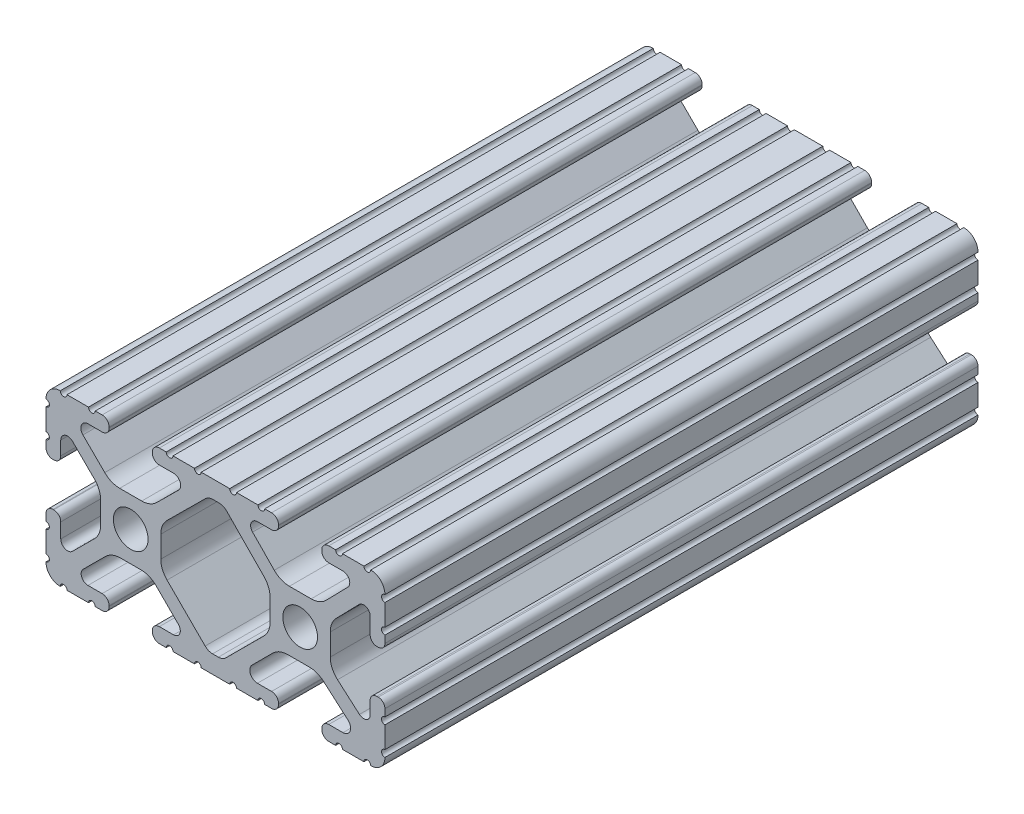
from build123d import *

# Parameters (mm, degrees)
SKETCH1_R           = 2.6035
BOSS_EXTRUDE1_DEPTH = 44.45


with BuildPart() as part:
    # Sketch1 → Boss-Extrude1 (new, symmetric)
    with BuildSketch(Plane.XY):
        with BuildLine():
            Line((18.01710265, 12.7), (16.98745015, 12.7))
            ThreePointArc((16.98745015, 12.7), (16.245730386, 12.392769614), (15.9385, 11.65104985))
            Line((15.9385, 11.65104985), (15.9385, 11.53922))
            ThreePointArc((15.9385, 11.53922), (16.245750844, 10.797450844), (16.98752, 10.4902))
            Line((16.98752, 10.4902), (19.116384363, 10.4902))
            ThreePointArc((19.116384363, 10.4902), (20.052502933, 9.869096983), (19.844087081, 8.765172272))
            Line((19.844087081, 8.765172272), (16.618993479, 5.455112286))
            ThreePointArc((16.618993479, 5.455112286), (15.578994274, 4.745442459), (14.344932584, 4.4958))
            Line((14.344932584, 4.4958), (11.083317835, 4.4958))
            ThreePointArc((11.083317835, 4.4958), (9.854330953, 4.743306833), (8.816955189, 5.447238587))
            Line((8.816955189, 5.447238587), (5.564154119, 8.762652677))
            ThreePointArc((5.564154119, 8.762652677), (5.352591412, 9.867473037), (6.289393385, 10.4902))
            Line((6.289393385, 10.4902), (8.41248, 10.4902))
            ThreePointArc((8.41248, 10.4902), (9.154249156, 10.797450844), (9.4615, 11.53922))
            Line((9.4615, 11.53922), (9.4615, 11.65104985))
            ThreePointArc((9.4615, 11.65104985), (9.154269614, 12.392769614), (8.41254985, 12.7))
            Line((8.41254985, 12.7), (7.38288465, 12.7))
            ThreePointArc((7.38288465, 12.7), (6.87488465, 12.192), (6.36688465, 12.7))
            Line((6.36688465, 12.7), (3.14958095, 12.7))
            ThreePointArc((3.14958095, 12.7), (2.64158095, 12.192), (2.13358095, 12.7))
            Line((2.13358095, 12.7), (-2.13358095, 12.7))
            ThreePointArc((-2.13358095, 12.7), (-2.64158095, 12.192), (-3.14958095, 12.7))
            Line((-3.14958095, 12.7), (-6.36689735, 12.7))
            ThreePointArc((-6.36689735, 12.7), (-6.87489735, 12.192), (-7.38289735, 12.7))
            Line((-7.38289735, 12.7), (-8.41254985, 12.7))
            ThreePointArc((-8.41254985, 12.7), (-9.154269614, 12.392769614), (-9.4615, 11.65104985))
            Line((-9.4615, 11.65104985), (-9.4615, 11.53922))
            ThreePointArc((-9.4615, 11.53922), (-9.154249156, 10.797450844), (-8.41248, 10.4902))
            Line((-8.41248, 10.4902), (-6.283641037, 10.4902))
            ThreePointArc((-6.283641037, 10.4902), (-5.297291557, 9.829633109), (-5.532576693, 8.666071843))
            Line((-5.532576693, 8.666071843), (-8.809985098, 5.416263103))
            ThreePointArc((-8.809985098, 5.416263103), (-9.836720513, 4.734920264), (-11.045536121, 4.4958))
            Line((-11.045536121, 4.4958), (-14.354463879, 4.4958))
            ThreePointArc((-14.354463879, 4.4958), (-15.563279487, 4.734920264), (-16.590014902, 5.416263103))
            Line((-16.590014902, 5.416263103), (-19.867423307, 8.666071843))
            ThreePointArc((-19.867423307, 8.666071843), (-20.102708443, 9.829633109), (-19.116358963, 10.4902))
            Line((-19.116358963, 10.4902), (-16.98752, 10.4902))
            ThreePointArc((-16.98752, 10.4902), (-16.245750844, 10.797450844), (-15.9385, 11.53922))
            Line((-15.9385, 11.53922), (-15.9385, 11.65104985))
            ThreePointArc((-15.9385, 11.65104985), (-16.245730386, 12.392769614), (-16.98745015, 12.7))
            Line((-16.98745015, 12.7), (-18.01711535, 12.7))
            ThreePointArc((-18.01711535, 12.7), (-18.52511535, 12.192), (-19.03311535, 12.7))
            Line((-19.03311535, 12.7), (-22.2504, 12.7))
            ThreePointArc((-22.2504, 12.7), (-22.758323491, 12.192000006), (-23.266399977, 12.699846982))
            ThreePointArc((-23.266399977, 12.699846982), (-24.782522516, 12.082522516), (-25.399846982, 10.566399977))
            ThreePointArc((-25.399846982, 10.566399977), (-24.892000006, 10.058323491), (-25.4, 9.5504))
            Line((-25.4, 9.5504), (-25.4, 6.3330836))
            ThreePointArc((-25.4, 6.3330836), (-24.892, 5.8250836), (-25.4, 5.3170836))
            Line((-25.4, 5.3170836), (-25.4, 4.237520184))
            ThreePointArc((-25.4, 4.237520184), (-25.107393763, 3.531106237), (-24.400979816, 3.2385))
            Line((-24.400979816, 3.2385), (-24.23922, 3.2385))
            ThreePointArc((-24.23922, 3.2385), (-23.497450844, 3.545750844), (-23.1902, 4.28752))
            Line((-23.1902, 4.28752), (-23.1902, 6.334741132))
            ThreePointArc((-23.1902, 6.334741132), (-22.556026952, 7.286023527), (-21.434002553, 7.066535717))
            Line((-21.434002553, 7.066535717), (-18.147950853, 3.808156468))
            ThreePointArc((-18.147950853, 3.808156468), (-17.452759693, 2.774838327), (-17.208501877, 1.553619571))
            Line((-17.208501877, 1.553619571), (-17.208501877, -1.695179196))
            ThreePointArc((-17.208501877, -1.695179196), (-17.450738657, -2.911536421), (-18.140486065, -3.942289578))
            Line((-18.140486065, -3.942289578), (-21.431579576, -7.227386226))
            ThreePointArc((-21.431579576, -7.227386226), (-22.55444896, -7.449940594), (-23.1902, -6.498002195))
            Line((-23.1902, -6.498002195), (-23.1902, -4.28752))
            ThreePointArc((-23.1902, -4.28752), (-23.497450844, -3.545750844), (-24.23922, -3.2385))
            Line((-24.23922, -3.2385), (-24.35098, -3.2385))
            ThreePointArc((-24.35098, -3.2385), (-25.092749156, -3.545750844), (-25.4, -4.28752))
            Line((-25.4, -4.28752), (-25.4, -5.3171344))
            ThreePointArc((-25.4, -5.3171344), (-24.892, -5.8251344), (-25.4, -6.3331344))
            Line((-25.4, -6.3331344), (-25.4, -9.5504))
            ThreePointArc((-25.4, -9.5504), (-24.892000006, -10.058323491), (-25.399846982, -10.566399977))
            ThreePointArc((-25.399846982, -10.566399977), (-24.782522516, -12.082522516), (-23.266399977, -12.699846982))
            ThreePointArc((-23.266399977, -12.699846982), (-22.758323491, -12.192000006), (-22.2504, -12.7))
            Line((-22.2504, -12.7), (-19.03308995, -12.7))
            ThreePointArc((-19.03308995, -12.7), (-18.52508995, -12.192), (-18.01708995, -12.7))
            Line((-18.01708995, -12.7), (-16.9874692, -12.7))
            ThreePointArc((-16.9874692, -12.7), (-16.245700044, -12.392749156), (-15.9384492, -11.65098))
            Line((-15.9384492, -11.65098), (-15.9384492, -11.53922))
            ThreePointArc((-15.9384492, -11.53922), (-16.245700044, -10.797450844), (-16.9874692, -10.4902))
            Line((-16.9874692, -10.4902), (-19.116358963, -10.4902))
            ThreePointArc((-19.116358963, -10.4902), (-20.055197748, -9.862578342), (-19.834124023, -8.755124678))
            Line((-19.834124023, -8.755124678), (-16.49660751, -5.423689618))
            ThreePointArc((-16.49660751, -5.423689618), (-15.467274017, -4.736928798), (-14.253591699, -4.4958))
            Line((-14.253591699, -4.4958), (-11.146408301, -4.4958))
            ThreePointArc((-11.146408301, -4.4958), (-9.932725983, -4.736928798), (-8.90339249, -5.423689618))
            Line((-8.90339249, -5.423689618), (-5.565875977, -8.755124678))
            ThreePointArc((-5.565875977, -8.755124678), (-5.344802252, -9.862578342), (-6.283641037, -10.4902))
            Line((-6.283641037, -10.4902), (-8.4125308, -10.4902))
            ThreePointArc((-8.4125308, -10.4902), (-9.154299956, -10.797450844), (-9.4615508, -11.53922))
            Line((-9.4615508, -11.53922), (-9.4615508, -11.65098))
            ThreePointArc((-9.4615508, -11.65098), (-9.154299956, -12.392749156), (-8.4125308, -12.7))
            Line((-8.4125308, -12.7), (-7.38287195, -12.7))
            ThreePointArc((-7.38287195, -12.7), (-6.87487195, -12.192), (-6.36687195, -12.7))
            Line((-6.36687195, -12.7), (-3.14960635, -12.7))
            ThreePointArc((-3.14960635, -12.7), (-2.64160635, -12.192), (-2.13360635, -12.7))
            Line((-2.13360635, -12.7), (2.13360635, -12.7))
            ThreePointArc((2.13360635, -12.7), (2.64159365, -12.1920127), (3.14958095, -12.7))
            Line((3.14958095, -12.7), (6.36691005, -12.7))
            ThreePointArc((6.36691005, -12.7), (6.87491005, -12.192), (7.38291005, -12.7))
            Line((7.38291005, -12.7), (8.4125308, -12.7))
            ThreePointArc((8.4125308, -12.7), (9.154299956, -12.392749156), (9.4615508, -11.65098))
            Line((9.4615508, -11.65098), (9.4615508, -11.53922))
            ThreePointArc((9.4615508, -11.53922), (9.154299956, -10.797450844), (8.4125308, -10.4902))
            Line((8.4125308, -10.4902), (6.289393385, -10.4902))
            ThreePointArc((6.289393385, -10.4902), (5.231590322, -9.783049717), (5.480677245, -8.535265862))
            Line((5.480677245, -8.535265862), (8.597933595, -5.423689618))
            ThreePointArc((8.597933595, -5.423689618), (9.627267088, -4.736928798), (10.840949406, -4.4958))
            Line((10.840949406, -4.4958), (14.102564155, -4.4958))
            ThreePointArc((14.102564155, -4.4958), (15.215927525, -4.697410182), (16.187895372, -5.276636531))
            Line((16.187895372, -5.276636531), (19.868247549, -8.482246082))
            ThreePointArc((19.868247549, -8.482246082), (20.188435806, -9.746879864), (19.116384363, -10.4902))
            Line((19.116384363, -10.4902), (16.9874692, -10.4902))
            ThreePointArc((16.9874692, -10.4902), (16.245700044, -10.797450844), (15.9384492, -11.53922))
            Line((15.9384492, -11.53922), (15.9384492, -11.65098))
            ThreePointArc((15.9384492, -11.65098), (16.245700044, -12.392749156), (16.9874692, -12.7))
            Line((16.9874692, -12.7), (18.01710265, -12.7))
            ThreePointArc((18.01710265, -12.7), (18.52510265, -12.192), (19.03310265, -12.7))
            Line((19.03310265, -12.7), (22.2504, -12.7))
            ThreePointArc((22.2504, -12.7), (22.758323491, -12.192000006), (23.266399977, -12.699846982))
            ThreePointArc((23.266399977, -12.699846982), (24.782522516, -12.082522516), (25.399846982, -10.566399977))
            ThreePointArc((25.399846982, -10.566399977), (24.892000006, -10.058323492), (25.4, -9.550400001))
            Line((25.4, -9.550400001), (25.4, -6.333083592))
            ThreePointArc((25.4, -6.333083592), (24.892000001, -5.825083593), (25.4, -5.317083593))
            Line((25.4, -5.317083593), (25.4, -4.237520184))
            ThreePointArc((25.4, -4.237520184), (25.107393763, -3.531106237), (24.400979816, -3.2385))
            Line((24.400979816, -3.2385), (24.189220184, -3.2385))
            ThreePointArc((24.189220184, -3.2385), (23.482806237, -3.531106237), (23.1902, -4.237520184))
            Line((23.1902, -4.237520184), (23.1902, -6.155876159))
            ThreePointArc((23.1902, -6.155876159), (22.62232736, -7.038258539), (21.583974541, -6.886926384))
            Line((21.583974541, -6.886926384), (18.29817066, -4.024970844))
            ThreePointArc((18.29817066, -4.024970844), (17.493730985, -2.946044689), (17.208501877, -1.630807374))
            Line((17.208501877, -1.630807374), (17.208501877, 1.630807374))
            ThreePointArc((17.208501877, 1.630807374), (17.442348332, 2.82673414), (18.109440981, 3.846495088))
            Line((18.109440981, 3.846495088), (21.526346532, 7.353420386))
            ThreePointArc((21.526346532, 7.353420386), (22.585896263, 7.574939077), (23.1902, 6.676867167))
            Line((23.1902, 6.676867167), (23.1902, 4.237520184))
            ThreePointArc((23.1902, 4.237520184), (23.482806237, 3.531106237), (24.189220184, 3.2385))
            Line((24.189220184, 3.2385), (24.400979816, 3.2385))
            ThreePointArc((24.400979816, 3.2385), (25.107393763, 3.531106237), (25.4, 4.237520184))
            Line((25.4, 4.237520184), (25.4, 5.3170836))
            ThreePointArc((25.4, 5.3170836), (24.891949193, 5.825134407), (25.4, 6.333185215))
            Line((25.4, 6.333185215), (25.4, 9.550400015))
            ThreePointArc((25.4, 9.550400015), (24.892000013, 10.058323498), (25.399846982, 10.566399977))
            ThreePointArc((25.399846982, 10.566399977), (24.782522516, 12.082522516), (23.266399977, 12.699846982))
            ThreePointArc((23.266399977, 12.699846982), (22.758323491, 12.192000006), (22.2504, 12.7))
            Line((22.2504, 12.7), (19.03310265, 12.7))
            ThreePointArc((19.03310265, 12.7), (18.52510265, 12.192), (18.01710265, 12.7))
        make_face()
        with Locations((-12.7, 0)):
            Circle(SKETCH1_R, mode=Mode.SUBTRACT)
        with Locations((12.7, 0)):
            Circle(SKETCH1_R, mode=Mode.SUBTRACT)
        with BuildLine():
            Line((-7.259513935, -3.869413038), (-1.545748891, -9.572766749))
            ThreePointArc((-1.545748891, -9.572766749), (-1.035199478, -9.913400116), (-0.433213048, -10.033))
            Line((-0.433213048, -10.033), (0.433213048, -10.033))
            ThreePointArc((0.433213048, -10.033), (1.035199478, -9.913400116), (1.545748891, -9.572766749))
            Line((1.545748891, -9.572766749), (7.259513935, -3.869413038))
            ThreePointArc((7.259513935, -3.869413038), (7.949261343, -2.838659881), (8.191498123, -1.622302656))
            Line((8.191498123, -1.622302656), (8.191498123, 1.622302656))
            ThreePointArc((8.191498123, 1.622302656), (7.955573352, 2.823327967), (7.282860769, 3.845864069))
            Line((7.282860769, 3.845864069), (1.675572808, 9.561086461))
            ThreePointArc((1.675572808, 9.561086461), (1.161034429, 9.910236611), (0.551456936, 10.033))
            Line((0.551456936, 10.033), (-0.395199982, 10.033))
            ThreePointArc((-0.395199982, 10.033), (-0.994772524, 9.914396349), (-1.50403329, 9.576450301))
            Line((-1.50403329, 9.576450301), (-7.252049147, 3.876839553))
            ThreePointArc((-7.252049147, 3.876839553), (-7.947240307, 2.843521412), (-8.191498123, 1.622302656))
            Line((-8.191498123, 1.622302656), (-8.191498123, -1.622302656))
            ThreePointArc((-8.191498123, -1.622302656), (-7.949261343, -2.838659881), (-7.259513935, -3.869413038))
        make_face(mode=Mode.SUBTRACT)
    extrude(amount=BOSS_EXTRUDE1_DEPTH, both=True)


solid = part.part
